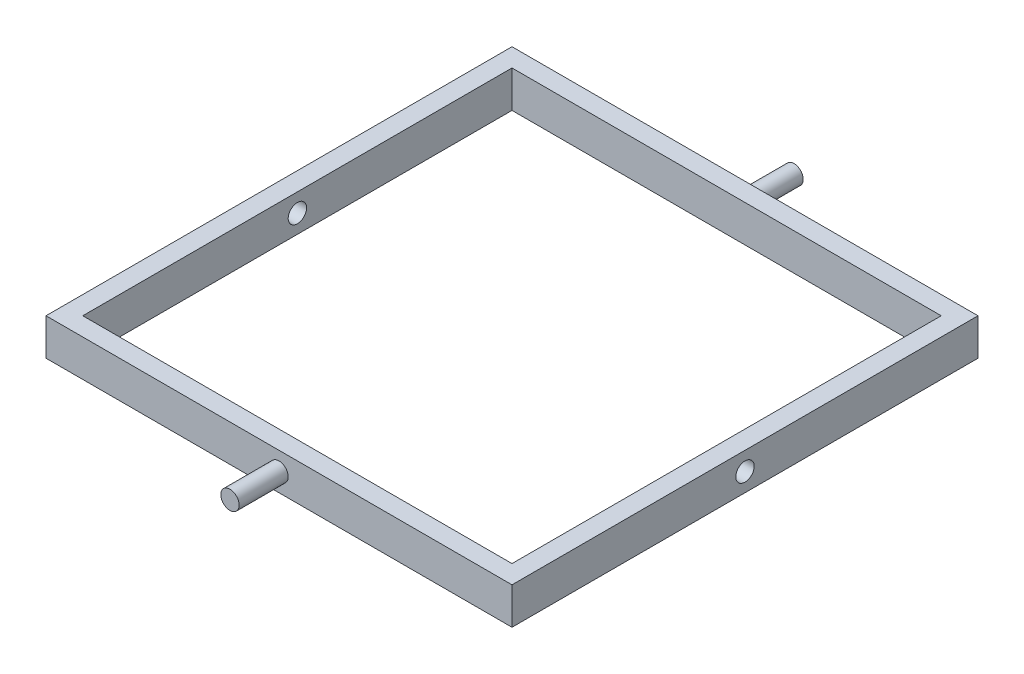
from build123d import *

# Parameters (mm, degrees)
SKETCH1_W               = 76
SKETCH1_H               = 76
SKETCH1_W_2             = 70
SKETCH1_H_2             = 70
EXTRUDE_THIN1_DEPTH     = 6
CUT_EXTRUDE1_DEPTH      = 83.516664984
CUT_EXTRUDE1_DEPTH_BACK = 83.516664984
SKETCH2_R               = 1.5
SKETCH3_R               = 1.5
BOSS_EXTRUDE1_DEPTH     = 8


with BuildPart() as part:
    # Sketch1 → Extrude-Thin1 (new body)
    with BuildSketch(Plane(origin=(0, 0, 0), x_dir=(1, 0, 0), z_dir=(0, 1, 0))):
        with Locations((-0.192988196, 0)):
            Rectangle(SKETCH1_W, SKETCH1_H)
        with Locations((-0.192988196, 0)):
            Rectangle(SKETCH1_W_2, SKETCH1_H_2, mode=Mode.SUBTRACT)
    extrude(amount=EXTRUDE_THIN1_DEPTH)

    # Sketch2 → Cut-Extrude1 (cut, two sides: drawn at the far end of the back side and taken through both)
    with BuildSketch(Plane.ZY.offset(-34.807011804).offset(-CUT_EXTRUDE1_DEPTH_BACK)):
        with Locations((0, 3)):
            Circle(SKETCH2_R)
    extrude(amount=CUT_EXTRUDE1_DEPTH + CUT_EXTRUDE1_DEPTH_BACK, mode=Mode.SUBTRACT)

    # Sketch3 → Boss-Extrude1 (add)
    with BuildSketch(Plane(origin=(0, 0, -38), x_dir=(-1, 0, 0), z_dir=(0, 0, -1))):
        with Locations(Location((0.192988196, 3, 0), (0, 0, 180))):
            Circle(SKETCH3_R)
    boss_extrude1 = extrude(amount=BOSS_EXTRUDE1_DEPTH)

    # Mirror1: Boss-Extrude1 across plane
    add(boss_extrude1.mirror(Plane.XY))


solid = part.part
